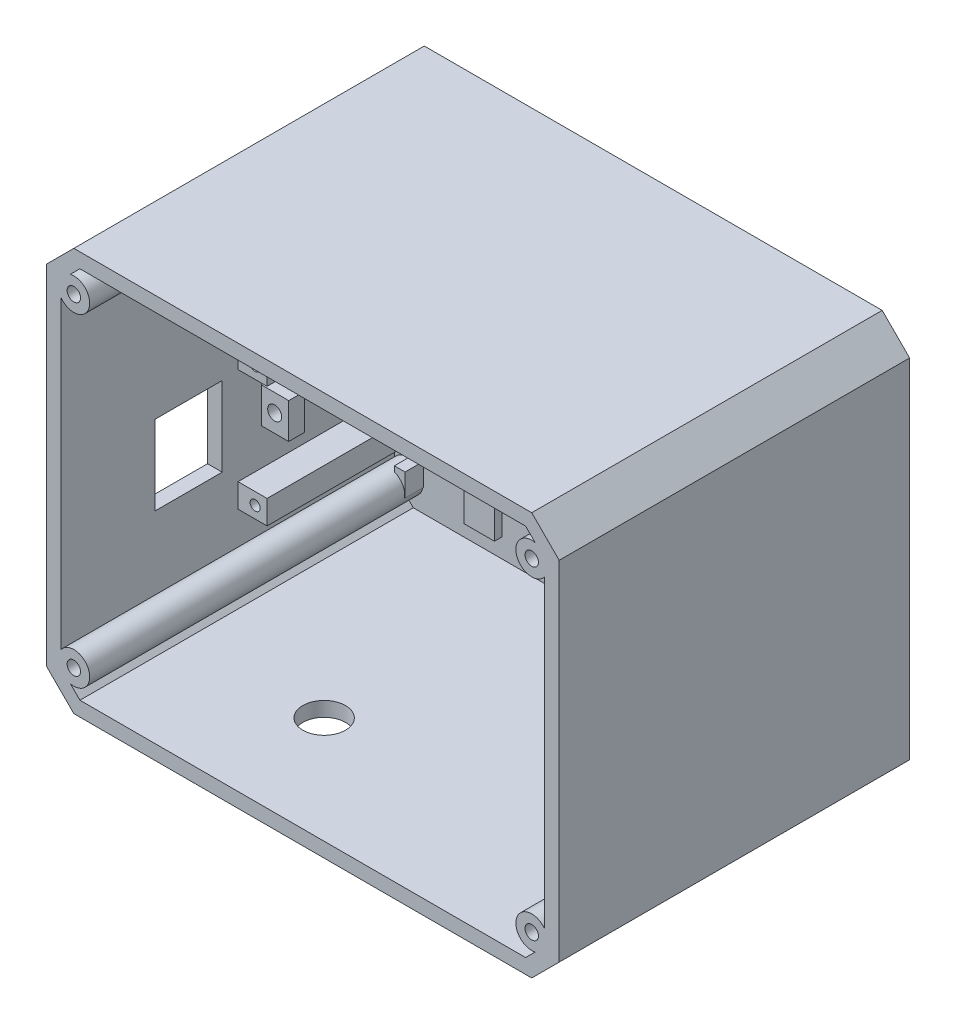
from build123d import *

# Parameters (mm, degrees)
F_84_X_66_FLOOR_WITH_CASE_SCREW_AND_BA_2_R       = 2.1
F_84_X_66_FLOOR_WITH_CASE_SCREW_AND_BATTER_DEPTH = 2.8
F_2_4_START                                      = 2.8
F_2_4_MM_PERIMETER_WALL_DEPTH                    = 54.6
LID_START                                        = 2.8
LID_D2_2_PILOTS_CORE_PROFILE_R                   = 2.6
LID_D2_2_PILOTS_CORE_DEPTH                       = 46.6
LID_START_2                                      = 49.4
LID_D2_2_PILOTS_PROFILE_R                        = 2.6
LID_D2_2_PILOTS_PROFILE_R_2                      = 1.1
LID_D2_2_PILOTS_DEPTH                            = 8
WALL_BACKED_START                                = 2.8
WALL_BACKED_SHELF_SUPPORT_RIBS_PROFILE_W         = 5.15
WALL_BACKED_SHELF_SUPPORT_RIBS_PROFILE_H         = 3.9
WALL_BACKED_SHELF_SUPPORT_RIBS_DEPTH             = 19.6
WALL_BACKED_START_2                              = 22.4
WALL_BACKED_SHELF_SUPPORT_D1_65_PILOTS_P_W       = 5.15
WALL_BACKED_SHELF_SUPPORT_D1_65_PILOTS_P_H       = 3.9
WALL_BACKED_SHELF_SUPPORT_D1_65_PILOTS_P_R       = 0.825
WALL_BACKED_SHELF_SUPPORT_D1_65_PILOTS_DEPTH     = 6
SENSOR_START                                     = 2.8
SENSOR_D1_65_PILOTS_19_MM_CENTERS_PROF_R         = 2.8
SENSOR_D1_65_PILOTS_19_MM_CENTERS_PROF_R_2       = 0.825
SENSOR_D1_65_PILOTS_19_MM_CENTERS_DEPTH          = 3.6
GNSS_START                                       = 2.8
GNSS_M2_D1_65_PILOTS_CENTERS_PROVI_2_R           = 2.65
GNSS_M2_D1_65_PILOTS_CENTERS_PROVI_2_R_2         = 0.825
GNSS_M2_D1_65_PILOTS_CENTERS_PROVISION_DEPTH     = 3.6
GNSS_PLAIN_SUPPORT_PROFILE_W                     = 3.9
GNSS_PLAIN_SUPPORT_PROFILE_H                     = 4.7
GNSS_PLAIN_SUPPORT_DEPTH                         = 3.6
BATTERY_START                                    = 2.8
BATTERY_END_STOPS_PROFILE_W                      = 1.75
BATTERY_END_STOPS_PROFILE_H                      = 3.7
BATTERY_END_STOPS_PROFILE_H_2                    = 3.9
BATTERY_END_STOPS_DEPTH                          = 3
BATTERY_SUPPORTS_WITH_STRAP_SPACE_BE_2_W         = 5
BATTERY_SUPPORTS_WITH_STRAP_SPACE_BE_2_H         = 29.5
BATTERY_SUPPORTS_WITH_STRAP_SPACE_BELOW_DEPTH    = 1.2
POWER_START                                      = 18.2
POWER_PLATE_RAISED_GUIDE_SEATS_PROFILE_W         = 6.1
POWER_PLATE_RAISED_GUIDE_SEATS_PROFILE_H         = 5.3
POWER_PLATE_RAISED_GUIDE_SEATS_DEPTH             = 2.4
POWER_START_2                                    = 20.6
POWER_PLATE_RAISED_GUIDE_CHANNELS_DEPTH          = 18.3
POWER_START_3                                    = 38.9
POWER_KEEPER_WASHER_D2_1_PILOTS_PROFILE_R        = 1.05
POWER_KEEPER_WASHER_D2_1_PILOTS_DEPTH            = 4.5
WALL_START                                       = 11
WALL_WIRING_TIE_EYE_AT_11_PROFILE_W              = 4.7
WALL_WIRING_TIE_EYE_AT_11_PROFILE_H              = 5.8
WALL_WIRING_TIE_EYE_AT_11_PROFILE_R              = 1.15
WALL_WIRING_TIE_EYE_AT_11_DEPTH                  = 2.6
WALL_START_2                                     = 22
WALL_WIRING_TIE_EYE_AT_22_PROFILE_W              = 4.7
WALL_WIRING_TIE_EYE_AT_22_PROFILE_H              = 5.8
WALL_WIRING_TIE_EYE_AT_22_PROFILE_R              = 1.15
WALL_WIRING_TIE_EYE_AT_22_DEPTH                  = 2.6
USB_START                                        = 42
USB_RESERVE_13_X_11_AT_LOWER_END_OF_2_W          = 3.4
USB_RESERVE_13_X_11_AT_LOWER_END_OF_2_H          = 13
USB_RESERVE_13_X_11_AT_LOWER_END_OF_PCB_DEPTH    = 11
D7_ROUND_PORT_FOR_D6_5_ANTENNA_18_2_R            = 3.5
D7_ROUND_PORT_FOR_D6_5_ANTENNA_18_FROM_DEPTH     = 2.5


with BuildPart() as part:
    # 84 x 66 floor with case screw and ba 2 → 84 x 66 floor with case screw and batter (new body)
    with BuildSketch(Plane.XY):
        Polygon((-37.5, -33), (37.5, -33), (42, -28.5), (42, 28.5), (37.5, 33), (-37.5, 33), (-42, 28.5), (-42, -28.5), align=None)
        with Locations((-37.2, -9)):
            Circle(F_84_X_66_FLOOR_WITH_CASE_SCREW_AND_BA_2_R, mode=Mode.SUBTRACT)
        with Locations((37.2, -9)):
            Circle(F_84_X_66_FLOOR_WITH_CASE_SCREW_AND_BA_2_R, mode=Mode.SUBTRACT)
        with Locations((-37.2, 17)):
            Circle(F_84_X_66_FLOOR_WITH_CASE_SCREW_AND_BA_2_R, mode=Mode.SUBTRACT)
        with Locations((37.2, 17)):
            Circle(F_84_X_66_FLOOR_WITH_CASE_SCREW_AND_BA_2_R, mode=Mode.SUBTRACT)
        with BuildLine():
            Line((-0.3, -30.55), (5.3, -30.55))
            ThreePointArc((5.3, -30.55), (6, -29.85), (5.3, -29.15))
            Line((5.3, -29.15), (-0.3, -29.15))
            ThreePointArc((-0.3, -29.15), (-1, -29.85), (-0.3, -30.55))
        make_face(mode=Mode.SUBTRACT)
        with BuildLine():
            Line((-0.1, 4.9), (5.1, 4.9))
            ThreePointArc((5.1, 4.9), (6, 5.8), (5.1, 6.7))
            Line((5.1, 6.7), (-0.1, 6.7))
            ThreePointArc((-0.1, 6.7), (-1, 5.8), (-0.1, 4.9))
        make_face(mode=Mode.SUBTRACT)
    extrude(amount=F_84_X_66_FLOOR_WITH_CASE_SCREW_AND_BATTER_DEPTH)

    # 2.4 mm perimeter wall profile → 2.4 mm perimeter wall (add)
    with BuildSketch(Plane.XY.offset(F_2_4_START)):
        Polygon((-37.5, -33), (37.5, -33), (42, -28.5), (42, 28.5), (37.5, 33), (-37.5, 33), (-42, 28.5), (-42, -28.5), align=None)
        Polygon((-36.5, -30.6), (36.5, -30.6), (39.6, -27.5), (39.6, 27.5), (36.5, 30.6), (-36.5, 30.6), (-39.6, 27.5), (-39.6, -27.5), align=None, mode=Mode.SUBTRACT)
    extrude(amount=F_2_4_MM_PERIMETER_WALL_DEPTH)

    # Lid D2.2 pilots core profile → Lid D2.2 pilots core (add)
    with BuildSketch(Plane.XY.offset(LID_START)):
        with Locations((-37.5, -26.5)):
            Circle(LID_D2_2_PILOTS_CORE_PROFILE_R)
        with Locations((37.5, -26.5)):
            Circle(LID_D2_2_PILOTS_CORE_PROFILE_R)
        with Locations((-37.5, 26.5)):
            Circle(LID_D2_2_PILOTS_CORE_PROFILE_R)
        with Locations((37.5, 26.5)):
            Circle(LID_D2_2_PILOTS_CORE_PROFILE_R)
    extrude(amount=LID_D2_2_PILOTS_CORE_DEPTH)

    # Lid D2.2 pilots profile → Lid D2.2 pilots (add)
    # profile 1 of 4: a face of its own
    with BuildSketch(Plane.XY.offset(LID_START_2)):
        with Locations((-37.5, -26.5)):
            Circle(LID_D2_2_PILOTS_PROFILE_R)
        with Locations((-37.5, -26.5)):
            Circle(LID_D2_2_PILOTS_PROFILE_R_2, mode=Mode.SUBTRACT)
    # profile 2 of 4: a face of its own
    with BuildSketch(Plane.XY.offset(LID_START_2)):
        with Locations((37.5, -26.5)):
            Circle(LID_D2_2_PILOTS_PROFILE_R)
        with Locations((37.5, -26.5)):
            Circle(LID_D2_2_PILOTS_PROFILE_R_2, mode=Mode.SUBTRACT)
    # profile 3 of 4: a face of its own
    with BuildSketch(Plane.XY.offset(LID_START_2)):
        with Locations((-37.5, 26.5)):
            Circle(LID_D2_2_PILOTS_PROFILE_R)
        with Locations((-37.5, 26.5)):
            Circle(LID_D2_2_PILOTS_PROFILE_R_2, mode=Mode.SUBTRACT)
    # profile 4 of 4: a face of its own
    with BuildSketch(Plane.XY.offset(LID_START_2)):
        with Locations((37.5, 26.5)):
            Circle(LID_D2_2_PILOTS_PROFILE_R)
        with Locations((37.5, 26.5)):
            Circle(LID_D2_2_PILOTS_PROFILE_R_2, mode=Mode.SUBTRACT)
    extrude(amount=LID_D2_2_PILOTS_DEPTH)

    # Wall-backed shelf support ribs profile → Wall-backed shelf support ribs (add)
    with BuildSketch(Plane.XY.offset(WALL_BACKED_START)):
        with Locations((37.425, -17.6)):
            Rectangle(WALL_BACKED_SHELF_SUPPORT_RIBS_PROFILE_W, WALL_BACKED_SHELF_SUPPORT_RIBS_PROFILE_H)
        with Locations((-37.425, -17.6)):
            Rectangle(WALL_BACKED_SHELF_SUPPORT_RIBS_PROFILE_W, WALL_BACKED_SHELF_SUPPORT_RIBS_PROFILE_H)
        with Locations((37.425, 2.2)):
            Rectangle(WALL_BACKED_SHELF_SUPPORT_RIBS_PROFILE_W, WALL_BACKED_SHELF_SUPPORT_RIBS_PROFILE_H)
        with Locations((-37.425, 2.2)):
            Rectangle(WALL_BACKED_SHELF_SUPPORT_RIBS_PROFILE_W, WALL_BACKED_SHELF_SUPPORT_RIBS_PROFILE_H)
    extrude(amount=WALL_BACKED_SHELF_SUPPORT_RIBS_DEPTH)

    # Wall-backed shelf support D1.65 pilots profile → Wall-backed shelf support D1.65 pilots (add)
    # profile 1 of 4: a face of its own
    with BuildSketch(Plane.XY.offset(WALL_BACKED_START_2)):
        with Locations((37.425, -17.6)):
            Rectangle(WALL_BACKED_SHELF_SUPPORT_D1_65_PILOTS_P_W, WALL_BACKED_SHELF_SUPPORT_D1_65_PILOTS_P_H)
        with Locations((36.8, -17.6)):
            Circle(WALL_BACKED_SHELF_SUPPORT_D1_65_PILOTS_P_R, mode=Mode.SUBTRACT)
    # profile 2 of 4: a face of its own
    with BuildSketch(Plane.XY.offset(WALL_BACKED_START_2)):
        with Locations((-37.425, -17.6)):
            Rectangle(WALL_BACKED_SHELF_SUPPORT_D1_65_PILOTS_P_W, WALL_BACKED_SHELF_SUPPORT_D1_65_PILOTS_P_H)
        with Locations((-36.8, -17.6)):
            Circle(WALL_BACKED_SHELF_SUPPORT_D1_65_PILOTS_P_R, mode=Mode.SUBTRACT)
    # profile 3 of 4: a face of its own
    with BuildSketch(Plane.XY.offset(WALL_BACKED_START_2)):
        with Locations((37.425, 2.2)):
            Rectangle(WALL_BACKED_SHELF_SUPPORT_D1_65_PILOTS_P_W, WALL_BACKED_SHELF_SUPPORT_D1_65_PILOTS_P_H)
        with Locations((36.8, 2.2)):
            Circle(WALL_BACKED_SHELF_SUPPORT_D1_65_PILOTS_P_R, mode=Mode.SUBTRACT)
    # profile 4 of 4: a face of its own
    with BuildSketch(Plane.XY.offset(WALL_BACKED_START_2)):
        with Locations((-37.425, 2.2)):
            Rectangle(WALL_BACKED_SHELF_SUPPORT_D1_65_PILOTS_P_W, WALL_BACKED_SHELF_SUPPORT_D1_65_PILOTS_P_H)
        with Locations((-36.8, 2.2)):
            Circle(WALL_BACKED_SHELF_SUPPORT_D1_65_PILOTS_P_R, mode=Mode.SUBTRACT)
    extrude(amount=WALL_BACKED_SHELF_SUPPORT_D1_65_PILOTS_DEPTH)

    # Sensor D1.65 pilots - 19 mm centers profile → Sensor D1.65 pilots - 19 mm centers (add)
    # profile 1 of 2: a face of its own
    with BuildSketch(Plane.XY.offset(SENSOR_START)):
        with Locations((7, 27)):
            Circle(SENSOR_D1_65_PILOTS_19_MM_CENTERS_PROF_R)
        with Locations((7, 27)):
            Circle(SENSOR_D1_65_PILOTS_19_MM_CENTERS_PROF_R_2, mode=Mode.SUBTRACT)
    # profile 2 of 2: a face of its own
    with BuildSketch(Plane.XY.offset(SENSOR_START)):
        with Locations((26, 27)):
            Circle(SENSOR_D1_65_PILOTS_19_MM_CENTERS_PROF_R)
        with Locations((26, 27)):
            Circle(SENSOR_D1_65_PILOTS_19_MM_CENTERS_PROF_R_2, mode=Mode.SUBTRACT)
    extrude(amount=SENSOR_D1_65_PILOTS_19_MM_CENTERS_DEPTH)

    # GNSS M2 D1.65 pilots - centers provi 2 → GNSS M2 D1.65 pilots - centers provision (add)
    # profile 1 of 2: a face of its own
    with BuildSketch(Plane.XY.offset(GNSS_START)):
        with Locations((-29.05, 7)):
            Circle(GNSS_M2_D1_65_PILOTS_CENTERS_PROVI_2_R)
        with Locations((-29.05, 7)):
            Circle(GNSS_M2_D1_65_PILOTS_CENTERS_PROVI_2_R_2, mode=Mode.SUBTRACT)
    # profile 2 of 2: a face of its own
    with BuildSketch(Plane.XY.offset(GNSS_START)):
        with Locations((-29.05, 27.8)):
            Circle(GNSS_M2_D1_65_PILOTS_CENTERS_PROVI_2_R)
        with Locations((-29.05, 27.8)):
            Circle(GNSS_M2_D1_65_PILOTS_CENTERS_PROVI_2_R_2, mode=Mode.SUBTRACT)
    extrude(amount=GNSS_M2_D1_65_PILOTS_CENTERS_PROVISION_DEPTH)

    # GNSS plain support profile → GNSS plain support (add)
    with BuildSketch(Plane.XY.offset(GNSS_START)):
        with Locations((-3.65, 24.65)):
            Rectangle(GNSS_PLAIN_SUPPORT_PROFILE_W, GNSS_PLAIN_SUPPORT_PROFILE_H)
    extrude(amount=GNSS_PLAIN_SUPPORT_DEPTH)

    # Battery end stops profile → Battery end stops (add)
    with BuildSketch(Plane.XY.offset(BATTERY_START)):
        with Locations((-35.725, -25.05)):
            Rectangle(BATTERY_END_STOPS_PROFILE_W, BATTERY_END_STOPS_PROFILE_H)
        with Locations((35.725, -25.15)):
            Rectangle(BATTERY_END_STOPS_PROFILE_W, BATTERY_END_STOPS_PROFILE_H_2)
    extrude(amount=BATTERY_END_STOPS_DEPTH)

    # Battery supports with strap space be 2 → Battery supports with strap space below (add)
    with BuildSketch(Plane.XY.offset(BATTERY_START)):
        with Locations((-24.5, -12.75)):
            Rectangle(BATTERY_SUPPORTS_WITH_STRAP_SPACE_BE_2_W, BATTERY_SUPPORTS_WITH_STRAP_SPACE_BE_2_H)
        with Locations((24.5, -12.75)):
            Rectangle(BATTERY_SUPPORTS_WITH_STRAP_SPACE_BE_2_W, BATTERY_SUPPORTS_WITH_STRAP_SPACE_BE_2_H)
    extrude(amount=BATTERY_SUPPORTS_WITH_STRAP_SPACE_BELOW_DEPTH)

    # Power plate raised guide seats profile → Power plate raised guide seats (add)
    with BuildSketch(Plane.XY.offset(POWER_START)):
        with Locations((-33.15, 28.45)):
            Rectangle(POWER_PLATE_RAISED_GUIDE_SEATS_PROFILE_W, POWER_PLATE_RAISED_GUIDE_SEATS_PROFILE_H)
        with Locations((33.15, 28.45)):
            Rectangle(POWER_PLATE_RAISED_GUIDE_SEATS_PROFILE_W, POWER_PLATE_RAISED_GUIDE_SEATS_PROFILE_H)
    extrude(amount=POWER_PLATE_RAISED_GUIDE_SEATS_DEPTH)

    # Power plate raised guide channels profile → Power plate raised guide channels (add)
    with BuildSketch(Plane.XY.offset(POWER_START_2)):
        Polygon((-30.1, 25.8), (-36.2, 25.8), (-36.2, 31.1), (-32.4, 31.1), (-32.4, 26.75), (-30.1, 26.75), align=None)
        Polygon((30.1, 25.8), (36.2, 25.8), (36.2, 31.1), (32.4, 31.1), (32.4, 26.75), (30.1, 26.75), align=None)
    extrude(amount=POWER_PLATE_RAISED_GUIDE_CHANNELS_DEPTH)

    # Power keeper washer D2.1 pilots profile → Power keeper washer D2.1 pilots (add)
    # profile 1 of 2: a face of its own
    with BuildSketch(Plane.XY.offset(POWER_START_3)):
        Polygon((-30.1, 25.8), (-36.2, 25.8), (-36.2, 31.1), (-32.4, 31.1), (-32.4, 26.75), (-30.1, 26.75), align=None)
        with Locations((-34.1, 28.4)):
            Circle(POWER_KEEPER_WASHER_D2_1_PILOTS_PROFILE_R, mode=Mode.SUBTRACT)
    # profile 2 of 2: a face of its own
    with BuildSketch(Plane.XY.offset(POWER_START_3)):
        Polygon((30.1, 25.8), (36.2, 25.8), (36.2, 31.1), (32.4, 31.1), (32.4, 26.75), (30.1, 26.75), align=None)
        with Locations((34.1, 28.4)):
            Circle(POWER_KEEPER_WASHER_D2_1_PILOTS_PROFILE_R, mode=Mode.SUBTRACT)
    extrude(amount=POWER_KEEPER_WASHER_D2_1_PILOTS_DEPTH)

    # Wall wiring tie eye at 11 profile → Wall wiring tie eye at 11 (add)
    with BuildSketch(Plane.XY.offset(WALL_START)):
        with Locations((-37.45, -6.7)):
            Rectangle(WALL_WIRING_TIE_EYE_AT_11_PROFILE_W, WALL_WIRING_TIE_EYE_AT_11_PROFILE_H)
        with Locations((-37.4, -6.7)):
            Circle(WALL_WIRING_TIE_EYE_AT_11_PROFILE_R, mode=Mode.SUBTRACT)
    extrude(amount=WALL_WIRING_TIE_EYE_AT_11_DEPTH)

    # Wall wiring tie eye at 22 profile → Wall wiring tie eye at 22 (add)
    with BuildSketch(Plane.XY.offset(WALL_START_2)):
        with Locations((-37.45, -6.7)):
            Rectangle(WALL_WIRING_TIE_EYE_AT_22_PROFILE_W, WALL_WIRING_TIE_EYE_AT_22_PROFILE_H)
        with Locations((-37.4, -6.7)):
            Circle(WALL_WIRING_TIE_EYE_AT_22_PROFILE_R, mode=Mode.SUBTRACT)
    extrude(amount=WALL_WIRING_TIE_EYE_AT_22_DEPTH)

    # USB reserve 13 x 11 at lower end of  2 → USB reserve 13 x 11 at lower end of PCB (cut)
    with BuildSketch(Plane.XY.offset(USB_START)):
        with Locations((-40.7, -6.5)):
            Rectangle(USB_RESERVE_13_X_11_AT_LOWER_END_OF_2_W, USB_RESERVE_13_X_11_AT_LOWER_END_OF_2_H)
    extrude(amount=-USB_RESERVE_13_X_11_AT_LOWER_END_OF_PCB_DEPTH, mode=Mode.SUBTRACT)

    # D7 round port for D6.5 antenna - 18  2 → D7 round port for D6.5 antenna - 18 from (cut)
    with BuildSketch(Plane.XZ.offset(33)):
        with Locations(Location((-14, 39.9, 0), (0, 0, 270))):
            Circle(D7_ROUND_PORT_FOR_D6_5_ANTENNA_18_2_R)
    extrude(amount=-D7_ROUND_PORT_FOR_D6_5_ANTENNA_18_FROM_DEPTH, mode=Mode.SUBTRACT)


solid = part.part
